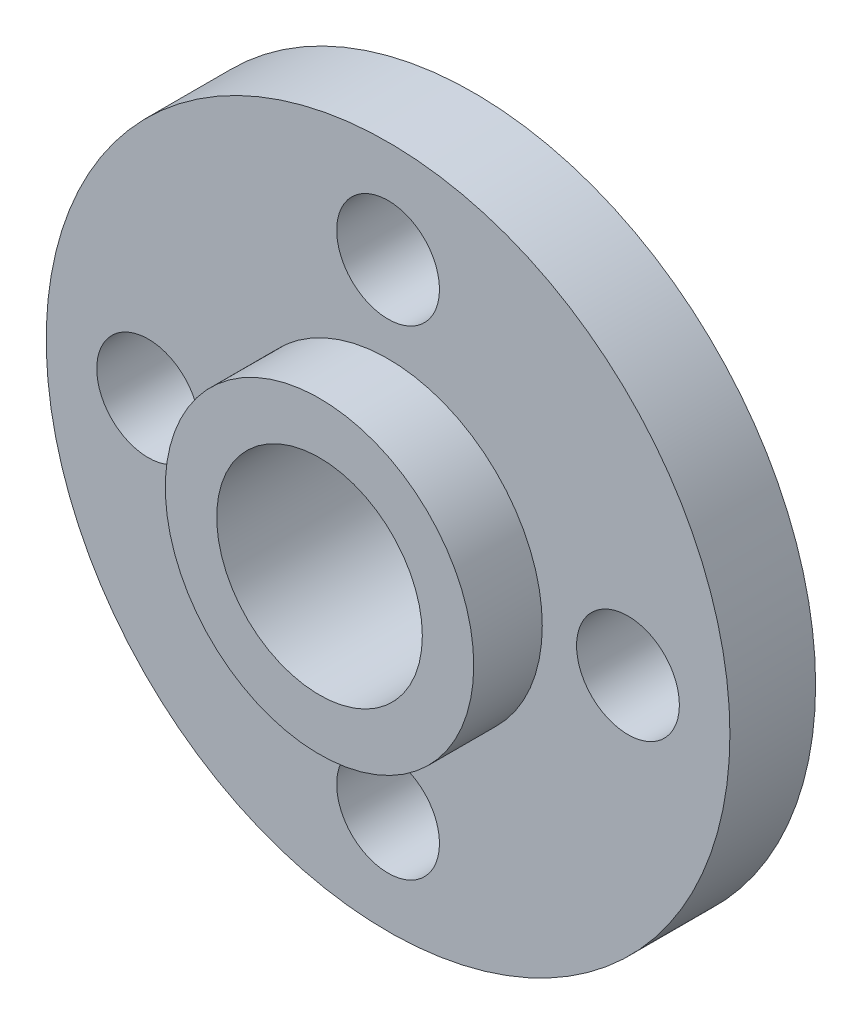
from build123d import *

# Parameters (mm, degrees)
SKETCH1_R           = 9.975
SKETCH1_R_2         = 1.5
BOSS_EXTRUDE1_DEPTH = 2.5
SKETCH2_R           = 4.5
BOSS_EXTRUDE2_DEPTH = 2
SKETCH3_R           = 3
CUT_EXTRUDE1_DEPTH  = 15.807135104


with BuildPart() as part:
    # Sketch1 → Boss-Extrude1 (new body)
    with BuildSketch(Plane.XY):
        Circle(SKETCH1_R)
        with Locations((0, 7)):
            Circle(SKETCH1_R_2, mode=Mode.SUBTRACT)
        with Locations((7, 0)):
            Circle(SKETCH1_R_2, mode=Mode.SUBTRACT)
        with Locations((0, -7)):
            Circle(SKETCH1_R_2, mode=Mode.SUBTRACT)
        with Locations((-7, 0)):
            Circle(SKETCH1_R_2, mode=Mode.SUBTRACT)
    extrude(amount=BOSS_EXTRUDE1_DEPTH)

    # Sketch2 → Boss-Extrude2 (add)
    with BuildSketch(Plane.XY.offset(2.5)):
        Circle(SKETCH2_R)
    extrude(amount=BOSS_EXTRUDE2_DEPTH)

    # Sketch3 → Cut-Extrude1 (cut, through all)
    with BuildSketch(Plane.XY.offset(4.5)):
        Circle(SKETCH3_R)
    extrude(amount=-CUT_EXTRUDE1_DEPTH, mode=Mode.SUBTRACT)


solid = part.part
